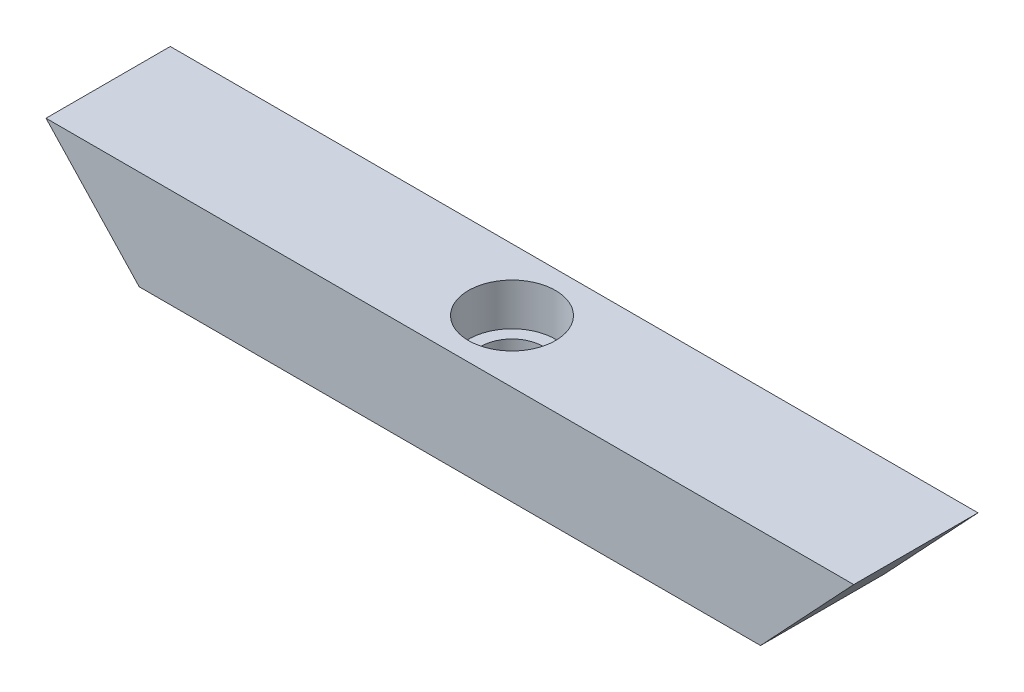
from build123d import *

# Parameters (mm, degrees)
BOSS_EXTRUDE1_DEPTH      = 50
CUT_EXTRUDE1_REACH       = 176.66
SKETCH2_R                = 17.5
BOSS_EXTRUDE2_DEPTH      = 3
BOSS_EXTRUDE2_DEPTH_BACK = 3
SKETCH3_R                = 17.5
SKETCH3_R_2              = 12.5


with BuildPart() as part:
    # Sketch1 → Boss-Extrude1 (new body)
    with BuildSketch(Plane.XY):
        Polygon((-162.5, 0), (162.5, 0), (125, -40), (-125, -40), align=None)
    extrude(amount=BOSS_EXTRUDE1_DEPTH)

    # Sketch2 → Cut-Extrude1 (cut, up to next)
    with BuildSketch(Plane(origin=(0, 0, 0), x_dir=(1, 0, 0), z_dir=(0, 1, 0)), mode=Mode.PRIVATE) as cut_extrude1_sk1:
        with Locations(Location((0, -25, 0), (0, 0, 270))):
            Circle(SKETCH2_R)
    cut_extrude1_tool1 = extrude(cut_extrude1_sk1.sketch, amount=-CUT_EXTRUDE1_REACH, mode=Mode.PRIVATE) & part.part
    add(cut_extrude1_tool1.solids().sort_by_distance((0, 0, 25))[0], mode=Mode.SUBTRACT)

    # Sketch3 → Boss-Extrude2 (add, two sides: drawn at the far end of the back side and taken through both)
    with BuildSketch(Plane(origin=(0, -20, 0), x_dir=(1, 0, 0), z_dir=(0, 1, 0)).offset(-BOSS_EXTRUDE2_DEPTH_BACK)):
        with Locations(Location((0, -25, 0), (0, 0, 270))):
            Circle(SKETCH3_R)
        with Locations(Location((0, -25, 0), (0, 0, 270))):
            Circle(SKETCH3_R_2, mode=Mode.SUBTRACT)
    extrude(amount=BOSS_EXTRUDE2_DEPTH + BOSS_EXTRUDE2_DEPTH_BACK)


solid = part.part
